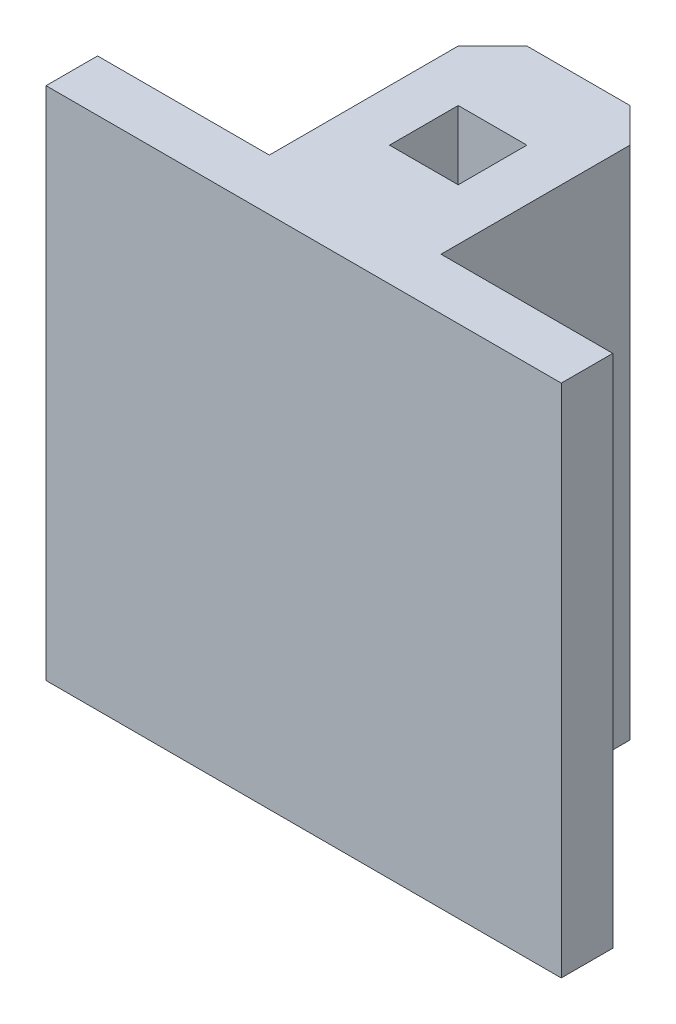
from build123d import *

# Parameters (mm, degrees)
SKETCH1_W           = 20
SKETCH1_H           = 20
BOSS_EXTRUDE1_DEPTH = 150
CHAMFER1_SIZE       = 10


with BuildPart() as part:
    # Sketch1 → Boss-Extrude1 (new body)
    with BuildSketch(Plane(origin=(0, 0, 0), x_dir=(1, 0, 0), z_dir=(0, 1, 0))):
        Polygon((-25, 35), (25, 35), (25, -30), (75, -30), (75, -45), (-75, -45), (-75, -30), (-25, -30), align=None)
        Rectangle(SKETCH1_W, SKETCH1_H, mode=Mode.SUBTRACT)
    extrude(amount=BOSS_EXTRUDE1_DEPTH)

    # Chamfer1
    chamfer1_edges = [part.edges().sort_by_distance(p)[0] for p in [
        (-25, 75, -35),
        (25, 75, -35),
    ]]
    chamfer(chamfer1_edges, length=CHAMFER1_SIZE)


solid = part.part
